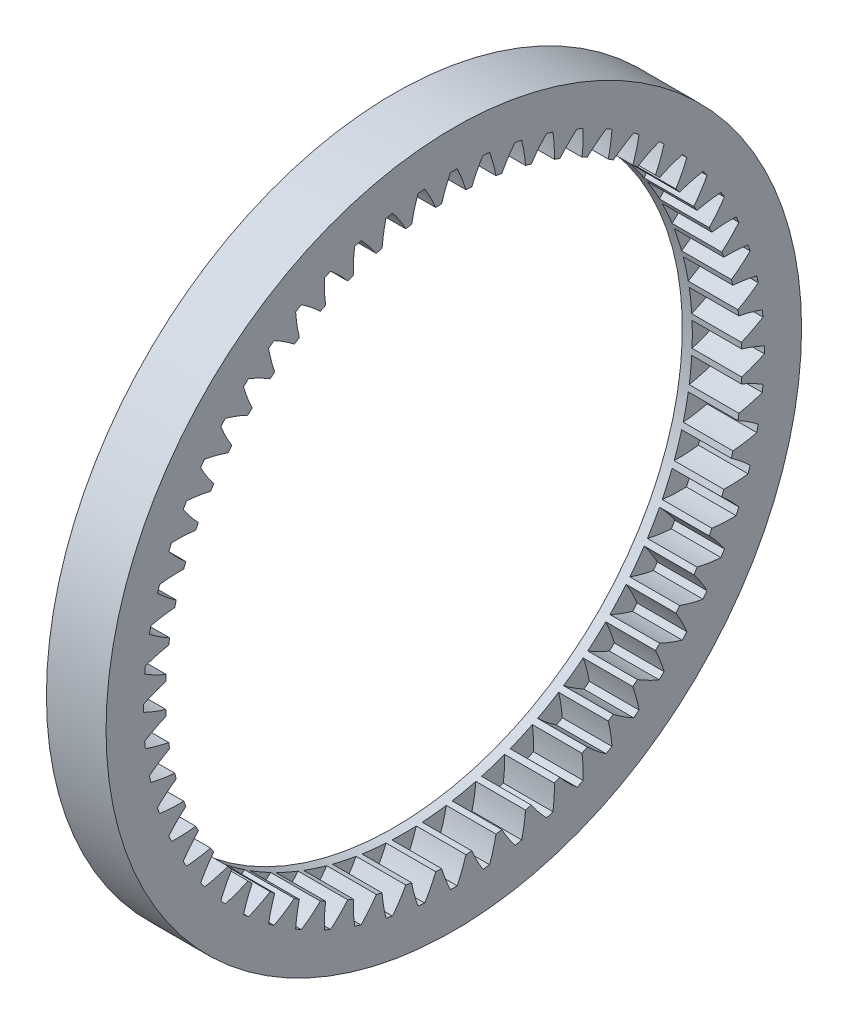
from build123d import *

# Parameters (mm, degrees)
BASPROSKE_W             = 5
BASPROSKE_H             = 6
TOOTHCUT_DEPTH          = 50.749371855
TEETHCUTS_COUNT         = 60
TEETHCUTS_ANGLE         = 354
SALIENTE_EXTRUIR1_START = 1
CROQUIS1_R              = 35
CROQUIS1_R_2            = 29
SALIENTE_EXTRUIR1_DEPTH = 1


with BuildPart() as part:
    # BasProSke → Base-Revolve (revolve)
    with BuildSketch(Plane(origin=(0, 0, 0), x_dir=(1, 0, 0), z_dir=(0, 1, 0)), mode=Mode.PRIVATE) as base_revolve_sk:
        with Locations((2.5, 32)):
            Rectangle(BASPROSKE_W, BASPROSKE_H)
    revolve(base_revolve_sk.sketch.rotate(Axis((-10, 0, 0), (1, 0, 0)), 180), axis=Axis((-10, 0, 0), (1, 0, 0)))

    # TooCutSke → ToothCut (cut, through all)
    with BuildSketch(Plane(origin=(0, 0, 0), x_dir=(0, 0, -1), z_dir=(1, 0, 0))):
        with BuildLine():
            ThreePointArc((1.227357706, 28.948593027), (0.830805794, 30.117149174), (0.339543276, 31.24915537))
            ThreePointArc((0.339543276, 31.24915537), (0, 31.251), (-0.339543276, 31.24915537))
            ThreePointArc((-0.339543276, 31.24915537), (-0.830805794, 30.117149174), (-1.227357706, 28.948593027))
            ThreePointArc((-1.227357706, 28.948593027), (0, 28.9746), (1.227357706, 28.948593027))
        make_face()
    toothcut = extrude(amount=TOOTHCUT_DEPTH, mode=Mode.SUBTRACT)

    # TeethCuts: ToothCut ×60 about axis
    teethcuts_axis = Axis((-10, 0, 0), (1, 0, 0))
    for i in range(1, TEETHCUTS_COUNT):
        add(toothcut.rotate(teethcuts_axis, i * TEETHCUTS_ANGLE / (TEETHCUTS_COUNT - 1)), mode=Mode.SUBTRACT)

    # Croquis1 → Saliente-Extruir1 (add)
    with BuildSketch(Plane.ZY.offset(SALIENTE_EXTRUIR1_START)):
        Circle(CROQUIS1_R)
        Circle(CROQUIS1_R_2, mode=Mode.SUBTRACT)
    extrude(amount=-SALIENTE_EXTRUIR1_DEPTH)


solid = part.part
